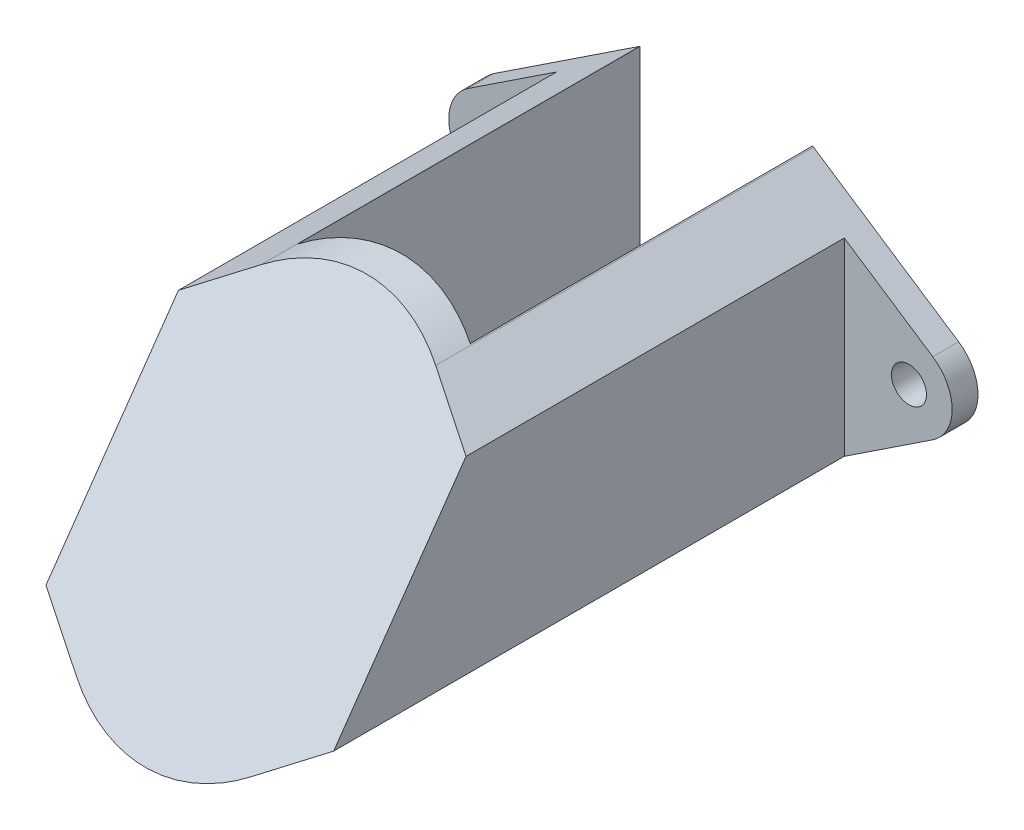
from build123d import *

# Parameters (mm, degrees)
BOSS_EXTRUDE1_DEPTH     = 45
CUT_EXTRUDE1_DEPTH      = 50.520197899
CUT_EXTRUDE1_DEPTH_BACK = 50.520197899
SKETCH3_OUTSIDE_W       = 59.222
SKETCH3_OUTSIDE_H       = 36.222
CUT_EXTRUDE2_START      = -1.8
SKETCH5_OUTSIDE_W       = 48.562
SKETCH5_OUTSIDE_H       = 35.562
SKETCH5_OUTSIDE_W_2     = 20
SKETCH5_OUTSIDE_H_2     = 24.414034222
CUT_EXTRUDE2_DEPTH      = 44.584787548
F_2_CLEARANCE_HOLE1_D   = 2.4384
CUT_EXTRUDE3_START      = -2
SKETCH8_W               = 12
SKETCH8_H               = 64.371558748
CUT_EXTRUDE3_DEPTH      = 37.508253404


with BuildPart() as part:
    # Sketch1 → Boss-Extrude1 (new body)
    with BuildSketch(Plane.XY):
        with BuildLine():
            Line((-16.155172414, 2.502079991), (-6.068965517, 9.1742933))
            ThreePointArc((-6.068965517, 9.1742933), (0, 11), (6.068965517, 9.1742933))
            Line((6.068965517, 9.1742933), (16.155172414, 2.502079991))
            ThreePointArc((16.155172414, 2.502079991), (17.5, 0), (16.155172414, -2.502079991))
            Line((16.155172414, -2.502079991), (6.068965517, -9.1742933))
            ThreePointArc((6.068965517, -9.1742933), (0, -11), (-6.068965517, -9.1742933))
            Line((-6.068965517, -9.1742933), (-16.155172414, -2.502079991))
            ThreePointArc((-16.155172414, -2.502079991), (-17.5, 0), (-16.155172414, 2.502079991))
        make_face()
    extrude(amount=BOSS_EXTRUDE1_DEPTH)

    # Sketch3 outside → Cut-Extrude1 (cut, two sides: drawn at the far end of the back side and taken through both)
    with BuildSketch(Plane(origin=(0, 0, 0), x_dir=(0, 0, -1), z_dir=(1, 0, 0)).offset(-CUT_EXTRUDE1_DEPTH_BACK)):
        with Locations((-22.5, 0)):
            Rectangle(SKETCH3_OUTSIDE_W, SKETCH3_OUTSIDE_H)
        Polygon((-25, 11), (-40.404565841, -11), (0, -11), (0, 11), align=None, mode=Mode.SUBTRACT)
    extrude(amount=CUT_EXTRUDE1_DEPTH + CUT_EXTRUDE1_DEPTH_BACK, mode=Mode.SUBTRACT)

    # Sketch5 outside → Cut-Extrude2 (cut, through all)
    with BuildSketch(Plane(origin=(0, 0, 0), x_dir=(-1, 0, 0), z_dir=(0, 0, -1)).offset(CUT_EXTRUDE2_START)):
        Rectangle(SKETCH5_OUTSIDE_W, SKETCH5_OUTSIDE_H)
        Rectangle(SKETCH5_OUTSIDE_W_2, SKETCH5_OUTSIDE_H_2, mode=Mode.SUBTRACT)
    extrude(amount=-CUT_EXTRUDE2_DEPTH, mode=Mode.SUBTRACT)

    # #2 Clearance Hole1 (through all)
    with Locations(Plane.XY.offset(1.8)):
        with Locations((14.5, 0), (-14.5, 0)):
            Hole(F_2_CLEARANCE_HOLE1_D / 2)

    # Sketch8 → Cut-Extrude3 (cut, through all)
    with BuildSketch(Plane(origin=(0, 15.365046972, 21.943561206), x_dir=(1, 0, 0), z_dir=(0, 0.5735764363510415, 0.819152044288995)).offset(CUT_EXTRUDE3_START)):
        Rectangle(SKETCH8_W, SKETCH8_H)
    extrude(amount=-CUT_EXTRUDE3_DEPTH, mode=Mode.SUBTRACT)


solid = part.part
